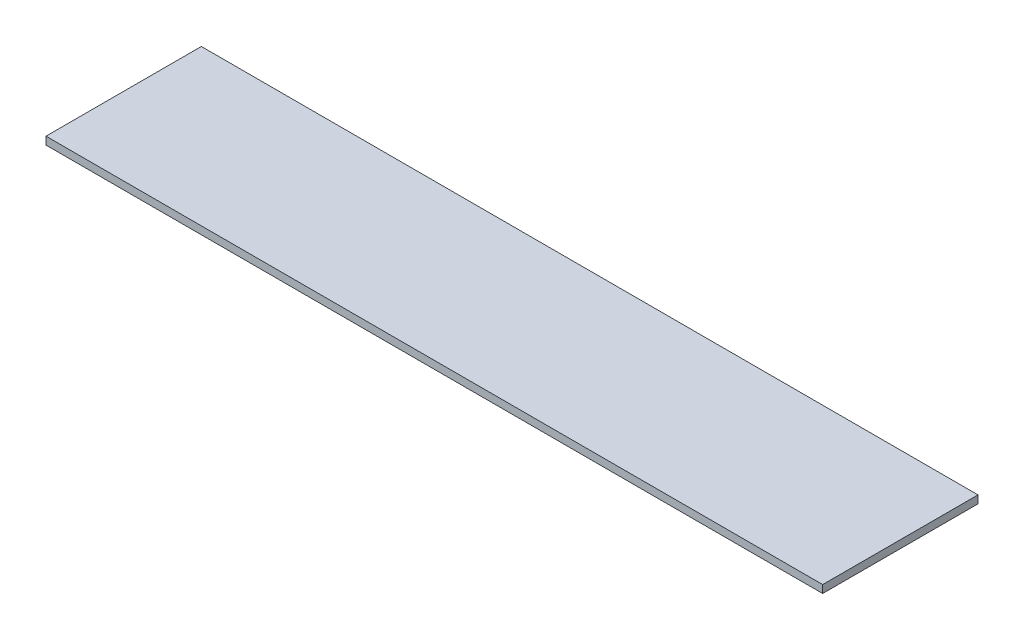
from build123d import *

# Parameters (mm, degrees)
SKETCH1_W           = 5080
SKETCH1_H           = 1016
BOSS_EXTRUDE1_DEPTH = 50.8


with BuildPart() as part:
    # Sketch1 → Boss-Extrude1 (new body)
    with BuildSketch(Plane(origin=(0, 0, 0), x_dir=(1, 0, 0), z_dir=(0, 1, 0))):
        with Locations((2297.468791501, 368.013280212)):
            Rectangle(SKETCH1_W, SKETCH1_H)
    extrude(amount=BOSS_EXTRUDE1_DEPTH)


solid = part.part
